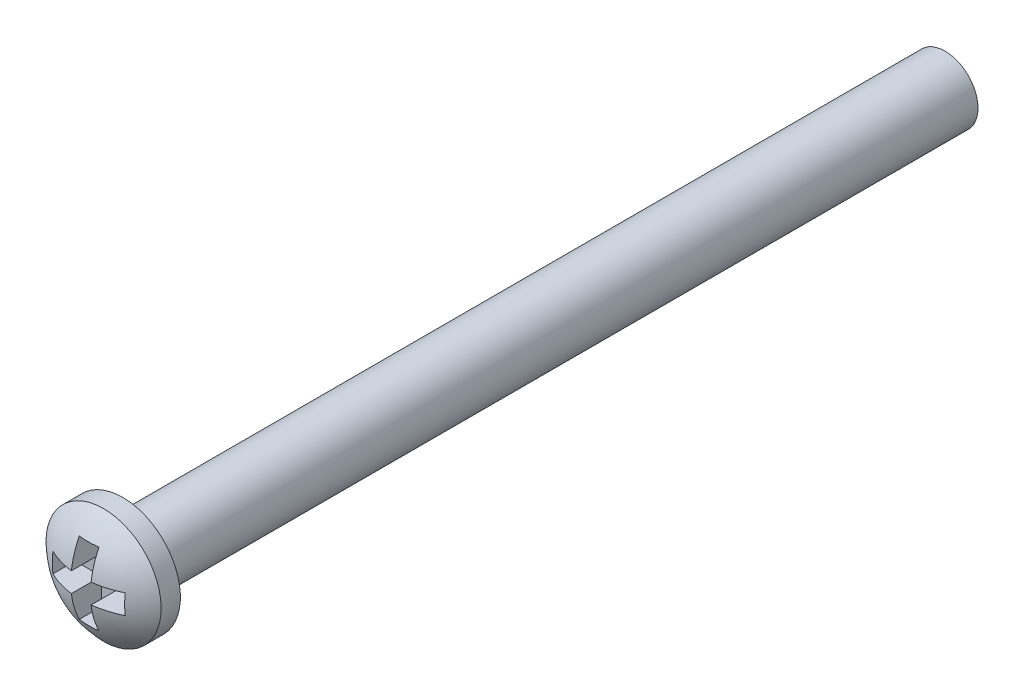
from build123d import *

# Parameters (mm, degrees)
SKETCH_1_R        = 1
EXTRUDE_198_DEPTH = 25
PH1_START         = 1.31
PH1_DEPTH         = 0.96


with BuildPart() as part:
    # 草图1 → Extrude 198 (new body)
    with BuildSketch(Plane.XY):
        Circle(SKETCH_1_R)
    extrude(amount=-EXTRUDE_198_DEPTH)

    # 草图6 → Revolve 324 (revolve)
    with BuildSketch(Plane(origin=(0, 0, 0), x_dir=(1, 0, 0), z_dir=(0, 1, 0)), mode=Mode.PRIVATE) as revolve_324_sk:
        with BuildLine():
            Line((0, 0), (1.75, 0))
            Line((1.75, 0), (1.75, -0.585357107))
            ThreePointArc((1.75, -0.585357107), (0.945147404, -1.114453798), (0, -1.3))
            Line((0, -1.3), (0, 0))
        make_face()
    revolve(revolve_324_sk.sketch.rotate(Axis((0, 0, -2), (0, 0, 1)), 180), axis=Axis((0, 0, -2), (0, 0, 1)))

    # 草图7 → 十字槽_PH1_简化 (cut)
    with BuildSketch(Plane.XY.offset(PH1_START)):
        Polygon((-0.3, -1.1), (0.3, -1.1), (0.3, -0.3), (1.1, -0.3), (1.1, 0.3), (0.3, 0.3), (0.3, 1.1), (-0.3, 1.1), (-0.3, 0.3), (-1.1, 0.3), (-1.1, -0.3), (-0.3, -0.3), align=None)
    extrude(amount=-PH1_DEPTH, mode=Mode.SUBTRACT)


solid = part.part
